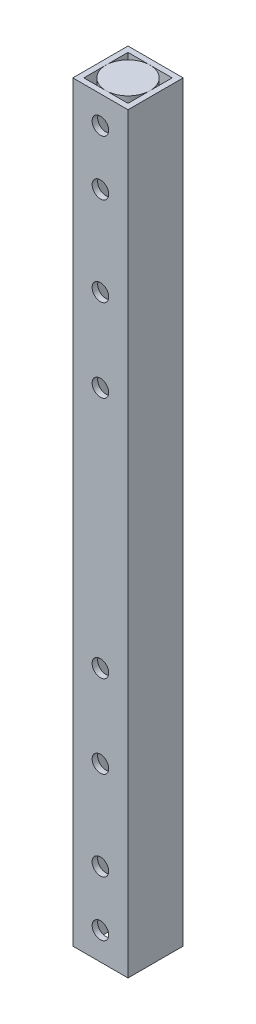
from build123d import *

# Parameters (mm, degrees)
SKETCH_1_W          = 10
SKETCH_1_H          = 10
EXTRUDE_1_DEPTH     = 136.24
SKETCH_2_R          = 1.5
CUT_EXTRUDE_1_DEPTH = 137.697979502
SKETCH_3_W          = 8
SKETCH_3_H          = 8
CUT_EXTRUDE_2_DEPTH = 137.423376296
SKETCH_4_R          = 4
EXTRUDE_1251_DEPTH  = 2


with BuildPart() as part:
    # 草图1 → 凸台-拉伸1 (new body)
    with BuildSketch(Plane(origin=(0, 0, 0), x_dir=(1, 0, 0), z_dir=(0, 1, 0))):
        Rectangle(SKETCH_1_W, SKETCH_1_H)
    extrude(amount=EXTRUDE_1_DEPTH)

    # 草图2 → 切除-拉伸1 (cut, through all)
    with BuildSketch(Plane.XY.offset(5)):
        with Locations((0, 5)):
            Circle(SKETCH_2_R)
        with Locations((0, 15)):
            Circle(SKETCH_2_R)
        with Locations((0, 121.24)):
            Circle(SKETCH_2_R)
        with Locations((0, 131.24)):
            Circle(SKETCH_2_R)
        with Locations((0, 46.12)):
            Circle(SKETCH_2_R)
        with Locations((0, 90.12)):
            Circle(SKETCH_2_R)
        with Locations((0, 31.12)):
            Circle(SKETCH_2_R)
        with Locations((0, 105.12)):
            Circle(SKETCH_2_R)
    extrude(amount=-CUT_EXTRUDE_1_DEPTH, mode=Mode.SUBTRACT)

    # 草图3 → 切除-拉伸2 (cut, through all)
    with BuildSketch(Plane(origin=(0, 136.24, 0), x_dir=(1, 0, 0), z_dir=(0, 1, 0))):
        Rectangle(SKETCH_3_W, SKETCH_3_H)
    extrude(amount=-CUT_EXTRUDE_2_DEPTH, mode=Mode.SUBTRACT)


with BuildPart() as body_2:
    # 草图4 → Extrude 1251 (new body)
    with BuildSketch(Plane(origin=(0, 136.24, 0), x_dir=(1, 0, 0), z_dir=(0, 1, 0))):
        Circle(SKETCH_4_R)
    extrude(amount=-EXTRUDE_1251_DEPTH)


solid = Compound([part.part, body_2.part])
